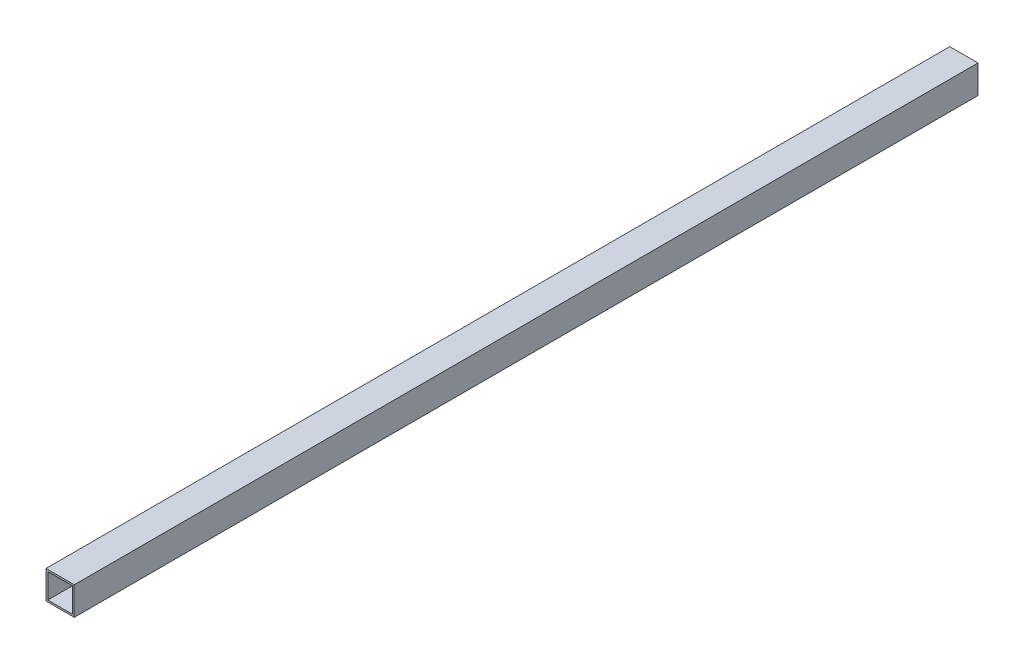
from build123d import *

# Parameters (mm, degrees)
SKETCH1_W           = 50.8
SKETCH1_H           = 50.8
SKETCH1_W_2         = 44.45
SKETCH1_H_2         = 44.45
BOSS_EXTRUDE1_DEPTH = 1625.6


with BuildPart() as part:
    # Sketch1 → Boss-Extrude1 (new body)
    with BuildSketch(Plane.XY):
        Rectangle(SKETCH1_W, SKETCH1_H)
        Rectangle(SKETCH1_W_2, SKETCH1_H_2, mode=Mode.SUBTRACT)
    extrude(amount=BOSS_EXTRUDE1_DEPTH)


solid = part.part
